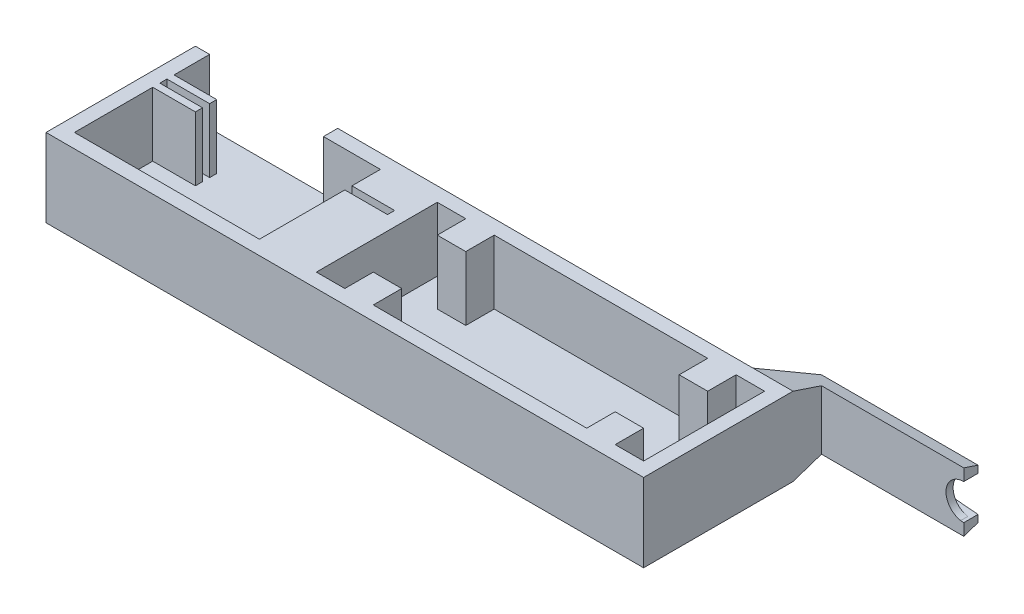
from build123d import *

# Parameters (mm, degrees)
BOSS_EXTRUDE1_DEPTH     = 2
SKETCH1_4_W             = 46
SKETCH1_4_H             = 17
BOSS_EXTRUDE2_DEPTH     = 11
SKETCH2_W               = 6
SKETCH2_H               = 3
SKETCH2_H_2             = 11
CUT_EXTRUDE1_DEPTH      = 9
SKETCH3_W               = 18
SKETCH3_H               = 9
CUT_EXTRUDE2_DEPTH      = 2
SKETCH4_W               = 4
SKETCH4_H               = 4
BOSS_EXTRUDE3_DEPTH     = 9
SKETCH6_R               = 0.5
CUT_EXTRUDE3_DEPTH      = 1
CUT_EXTRUDE4_DEPTH      = 2
CUT_EXTRUDE5_DEPTH      = 34
CUT_EXTRUDE5_DEPTH_BACK = 13


with BuildPart() as part:
    # Sketch1 → Boss-Extrude1 (new body)
    with BuildSketch(Plane(origin=(0, 0, 0), x_dir=(1, 0, 0), z_dir=(0, 1, 0))):
        Polygon((-42, 10.5), (-42, -10.5), (42, -10.5), (42, 14.5), (62, 14.5), (62, 16.5), (40, 16.5), (36.380121198, 10.5), align=None)
    extrude(amount=BOSS_EXTRUDE1_DEPTH)

    # Sketch1<4> → Boss-Extrude2 (add)
    with BuildSketch(Plane(origin=(0, 0, 0), x_dir=(1, 0, 0), z_dir=(0, 1, 0))):
        Polygon((-42, 10.5), (-42, -10.5), (42, -10.5), (42, 14.5), (62, 14.5), (62, 16.5), (40, 16.5), (36.380121198, 10.5), align=None)
        Polygon((-14, 3.5), (-14, -8.5), (-34, -8.5), (-34, 3.5), (-40, 3.5), (-40, 4.5), (-34, 4.5), (-34, 8.5), (-14, 8.5), (-14, 4.5), (-8, 4.5), (-8, 3.5), align=None, mode=Mode.SUBTRACT)
        with Locations((17, 0)):
            Rectangle(SKETCH1_4_W, SKETCH1_4_H, mode=Mode.SUBTRACT)
    extrude(amount=BOSS_EXTRUDE2_DEPTH)

    # Sketch2 → Cut-Extrude1 (cut)
    with BuildSketch(Plane(origin=(0, 11, 0), x_dir=(1, 0, 0), z_dir=(0, 1, 0))):
        with Locations((-37, 7)):
            Rectangle(SKETCH2_W, SKETCH2_H)
        with Locations((-37, -3)):
            Rectangle(SKETCH2_W, SKETCH2_H_2)
    extrude(amount=-CUT_EXTRUDE1_DEPTH, mode=Mode.SUBTRACT)

    # Sketch3 → Cut-Extrude2 (cut)
    with BuildSketch(Plane(origin=(0, 0, -10.5), x_dir=(-1, 0, 0), z_dir=(0, 0, -1))):
        with Locations((31, 6.5)):
            Rectangle(SKETCH3_W, SKETCH3_H)
    extrude(amount=-CUT_EXTRUDE2_DEPTH, mode=Mode.SUBTRACT)

    # Sketch4 → Boss-Extrude3 (add)
    with BuildSketch(Plane(origin=(0, 2, 0), x_dir=(1, 0, 0), z_dir=(0, 1, 0))):
        with Locations((0, 6.5)):
            Rectangle(SKETCH4_W, SKETCH4_H)
        with Locations((0, -6.5)):
            Rectangle(SKETCH4_W, SKETCH4_H)
        with Locations((34, 6.5)):
            Rectangle(SKETCH4_W, SKETCH4_H)
        with Locations((34, -6.5)):
            Rectangle(SKETCH4_W, SKETCH4_H)
    extrude(amount=BOSS_EXTRUDE3_DEPTH)

    # Sketch6 → Cut-Extrude3 (cut)
    with BuildSketch(Plane(origin=(0, 0, -16.5), x_dir=(-1, 0, 0), z_dir=(0, 0, -1))):
        with BuildLine():
            Line((-61.5684803, 3.037523452), (-50.5, 4))
            ThreePointArc((-50.5, 4), (-49, 5.5), (-50.5, 7))
            Line((-50.5, 7), (-61.5684803, 7.962476548))
            ThreePointArc((-61.5684803, 7.962476548), (-59.5, 5.5), (-61.5684803, 3.037523452))
        make_face()
        with Locations((-55.5, 5.5)):
            Circle(SKETCH6_R, mode=Mode.SUBTRACT)
        with Locations((-53, 5.5)):
            Circle(SKETCH6_R, mode=Mode.SUBTRACT)
        with Locations((-50.5, 5.5)):
            Circle(SKETCH6_R, mode=Mode.SUBTRACT)
    extrude(amount=-CUT_EXTRUDE3_DEPTH, mode=Mode.SUBTRACT)

    # Sketch6<3> → Cut-Extrude4 (cut)
    with BuildSketch(Plane(origin=(0, 0, -16.5), x_dir=(-1, 0, 0), z_dir=(0, 0, -1))):
        with BuildLine():
            Line((-62, 8), (-62, 3))
            Line((-62, 3), (-61.5684803, 3.037523452))
            ThreePointArc((-61.5684803, 3.037523452), (-60.085737838, 3.892019784), (-59.5, 5.5))
            ThreePointArc((-59.5, 5.5), (-60.085737838, 7.107980216), (-61.5684803, 7.962476548))
            Line((-61.5684803, 7.962476548), (-62, 8))
        make_face()
    extrude(amount=-CUT_EXTRUDE4_DEPTH, mode=Mode.SUBTRACT)

    # Sketch7 → Cut-Extrude5 (cut, two sides: drawn at the far end of the back side and taken through both)
    with BuildSketch(Plane(origin=(42, 0, 0), x_dir=(0, 0, -1), z_dir=(1, 0, 0)).offset(-CUT_EXTRUDE5_DEPTH_BACK)):
        Polygon((10.5, 0), (16.5, 2), (16.5, 0), align=None)
        Polygon((10.5, 11), (16.5, 9), (16.5, 11), align=None)
    extrude(amount=CUT_EXTRUDE5_DEPTH + CUT_EXTRUDE5_DEPTH_BACK, mode=Mode.SUBTRACT)


solid = part.part
